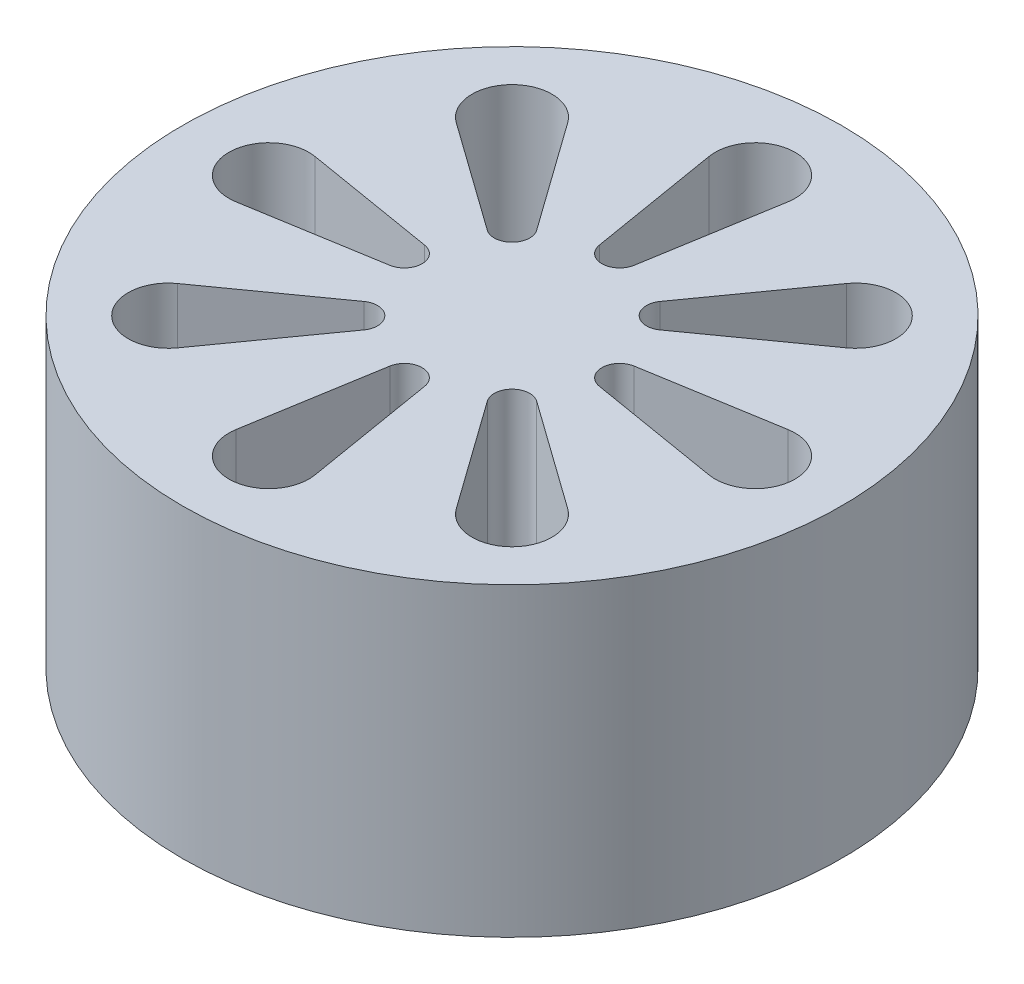
from build123d import *

# Parameters (mm, degrees)
SKETCH1_R           = 27.94
BOSS_EXTRUDE1_DEPTH = 25.89
CUT_EXTRUDE2_DEPTH  = 48.239594621
SKETCH4_R           = 4.5
SKETCH4_R_2         = 2
BOSS_EXTRUDE3_DEPTH = 7


with BuildPart() as part:
    # Sketch1 → Boss-Extrude1 (new body)
    with BuildSketch(Plane(origin=(0, 0, 0), x_dir=(1, 0, 0), z_dir=(0, 1, 0))):
        with Locations(Location((0, 0, 0), (0, 0, 270))):
            Circle(SKETCH1_R)
    extrude(amount=BOSS_EXTRUDE1_DEPTH)

    # Sketch2 → Cut-Extrude2 (cut, through all)
    with BuildSketch(Plane.XZ):
        with BuildLine():
            Line((1.479590886, 8.877545314), (3.342404051, 20.054424305))
            ThreePointArc((3.342404051, 20.054424305), (0, 24), (-3.342404051, 20.054424305))
            Line((-3.342404051, 20.054424305), (-1.479590886, 8.877545314))
            ThreePointArc((-1.479590886, 8.877545314), (0, 7.624143795), (1.479590886, 8.877545314))
        make_face()
        with BuildLine():
            Line((7.323601241, 5.231143743), (16.544055988, 11.817182849))
            ThreePointArc((16.544055988, 11.817182849), (16.970562748, 16.970562748), (11.817182849, 16.544055988))
            Line((11.817182849, 16.544055988), (5.231143743, 7.323601241))
            ThreePointArc((5.231143743, 7.323601241), (5.391083779, 5.391083779), (7.323601241, 5.231143743))
        make_face()
        with BuildLine():
            Line((8.877545314, -1.479590886), (20.054424305, -3.342404051))
            ThreePointArc((20.054424305, -3.342404051), (24, 0), (20.054424305, 3.342404051))
            Line((20.054424305, 3.342404051), (8.877545314, 1.479590886))
            ThreePointArc((8.877545314, 1.479590886), (7.624143795, 0), (8.877545314, -1.479590886))
        make_face()
        with BuildLine():
            Line((5.231143743, -7.323601241), (11.817182849, -16.544055988))
            ThreePointArc((11.817182849, -16.544055988), (16.970562748, -16.970562748), (16.544055988, -11.817182849))
            Line((16.544055988, -11.817182849), (7.323601241, -5.231143743))
            ThreePointArc((7.323601241, -5.231143743), (5.391083779, -5.391083779), (5.231143743, -7.323601241))
        make_face()
        with BuildLine():
            Line((-1.479590886, -8.877545314), (-3.342404051, -20.054424305))
            ThreePointArc((-3.342404051, -20.054424305), (0, -24), (3.342404051, -20.054424305))
            Line((3.342404051, -20.054424305), (1.479590886, -8.877545314))
            ThreePointArc((1.479590886, -8.877545314), (0, -7.624143795), (-1.479590886, -8.877545314))
        make_face()
        with BuildLine():
            Line((-7.323601241, -5.231143743), (-16.544055988, -11.817182849))
            ThreePointArc((-16.544055988, -11.817182849), (-16.970562748, -16.970562748), (-11.817182849, -16.544055988))
            Line((-11.817182849, -16.544055988), (-5.231143743, -7.323601241))
            ThreePointArc((-5.231143743, -7.323601241), (-5.391083779, -5.391083779), (-7.323601241, -5.231143743))
        make_face()
        with BuildLine():
            Line((-8.877545314, 1.479590886), (-20.054424305, 3.342404051))
            ThreePointArc((-20.054424305, 3.342404051), (-24, 0), (-20.054424305, -3.342404051))
            Line((-20.054424305, -3.342404051), (-8.877545314, -1.479590886))
            ThreePointArc((-8.877545314, -1.479590886), (-7.624143795, 0), (-8.877545314, 1.479590886))
        make_face()
        with BuildLine():
            Line((-5.231143743, 7.323601241), (-11.817182849, 16.544055988))
            ThreePointArc((-11.817182849, 16.544055988), (-16.970562748, 16.970562748), (-16.544055988, 11.817182849))
            Line((-16.544055988, 11.817182849), (-7.323601241, 5.231143743))
            ThreePointArc((-7.323601241, 5.231143743), (-5.391083779, 5.391083779), (-5.231143743, 7.323601241))
        make_face()
    extrude(amount=-CUT_EXTRUDE2_DEPTH, mode=Mode.SUBTRACT)

    # Sketch4 → Boss-Extrude3 (add)
    with BuildSketch(Plane(origin=(0, 0, 0), x_dir=(-1, 0, 0), z_dir=(0, -1, 0))):
        with Locations(Location((0, 0, 0), (0, 0, 270))):
            Circle(SKETCH4_R)
        with Locations(Location((0, 0, 0), (0, 0, 90))):
            Circle(SKETCH4_R_2, mode=Mode.SUBTRACT)
    extrude(amount=BOSS_EXTRUDE3_DEPTH)


solid = part.part
